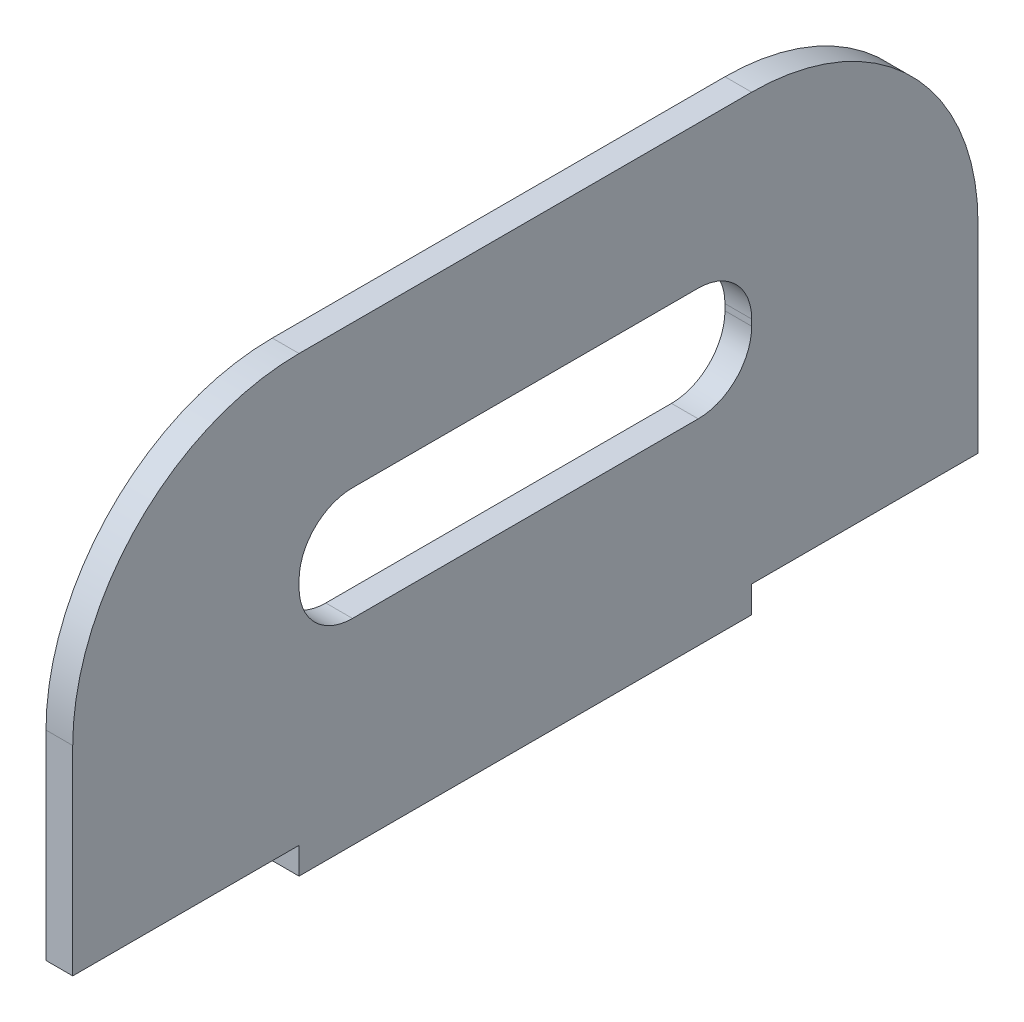
from build123d import *

# Parameters (mm, degrees)
SKETCH2_W           = 101.6
SKETCH2_H           = 50.8
BOSS_EXTRUDE1_DEPTH = 3
FILLET1_R           = 25.4
SKETCH4_W           = 25.4
SKETCH4_H           = 3
CUT_EXTRUDE1_DEPTH  = 3
SKETCH6_W           = 50.8
SKETCH6_H           = 12.7
CUT_EXTRUDE2_DEPTH  = 10
FILLET2_R           = 6


with BuildPart() as part:
    # Sketch2 → Boss-Extrude1 (new body)
    with BuildSketch(Plane(origin=(0, 0, 0), x_dir=(0, 0, -1), z_dir=(1, 0, 0))):
        with Locations((50.8, 25.4)):
            Rectangle(SKETCH2_W, SKETCH2_H)
    extrude(amount=BOSS_EXTRUDE1_DEPTH)

    # Fillet1
    fillet1_edges = [part.edges().sort_by_distance(p)[0] for p in [
        (1.5, 50.8, 0),
        (1.5, 50.8, -101.6),
    ]]
    fillet(fillet1_edges, radius=FILLET1_R)

    # Sketch4 → Cut-Extrude1 (cut)
    with BuildSketch(Plane(origin=(3, 0, 0), x_dir=(0, 0, -1), z_dir=(1, 0, 0))):
        with Locations((12.7, 1.5)):
            Rectangle(SKETCH4_W, SKETCH4_H)
        with Locations((88.9, 1.5)):
            Rectangle(SKETCH4_W, SKETCH4_H)
    extrude(amount=-CUT_EXTRUDE1_DEPTH, mode=Mode.SUBTRACT)

    # Sketch6 → Cut-Extrude2 (cut)
    with BuildSketch(Plane(origin=(3, 0, 0), x_dir=(0, 0, -1), z_dir=(1, 0, 0))):
        with Locations((50.8, 28.4)):
            Rectangle(SKETCH6_W, SKETCH6_H)
    extrude(amount=-CUT_EXTRUDE2_DEPTH, mode=Mode.SUBTRACT)

    # Fillet2
    fillet2_edges = [part.edges().sort_by_distance(p)[0] for p in [
        (1.5, 22.05, -25.4),
        (1.5, 34.75, -25.4),
        (1.5, 34.75, -76.2),
        (1.5, 22.05, -76.2),
    ]]
    fillet(fillet2_edges, radius=FILLET2_R)


solid = part.part
